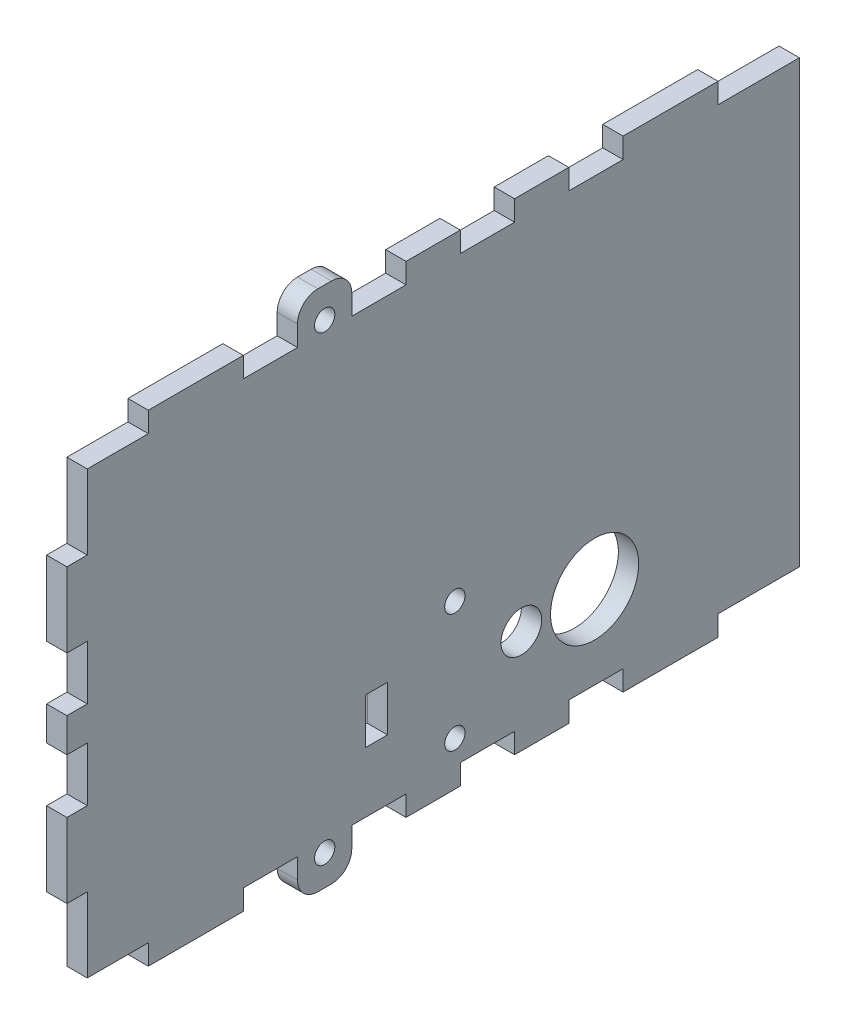
from build123d import *

# Parameters (mm, degrees)
CROQUIS1_W               = 108
CROQUIS1_H               = 71
SALIENTE_EXTRUIR1_DEPTH  = 1.5
CROQUIS2_W               = 12
CROQUIS2_H               = 3
CROQUIS2_W_2             = 8
CORTAR_EXTRUIR1_DEPTH    = 3
CROQUIS6_W               = 3
CROQUIS6_H               = 14
CROQUIS6_H_2             = 8
CORTAR_EXTRUIR3_DEPTH    = 3
CROQUIS7_R               = 1.5
CROQUIS7_R_2             = 3
CROQUIS7_R_3             = 6.5
CROQUIS7_W               = 3.259373519
CROQUIS7_H               = 6.723882433
CORTAR_EXTRUIR4_DEPTH    = 23
CROQUIS8_W               = 8
CROQUIS8_H               = 3
SALIENTE_EXTRUIR2_DEPTH  = 3
REDONDEO2_R              = 3
CROQUIS9_R               = 1.5
CORTAR_EXTRUIR5_DEPTH    = 3
REDONDEO2_OF_SIMETR_A1_R = 3


with BuildPart() as part:
    # Croquis1 → Saliente-Extruir1 (new, symmetric)
    with BuildSketch(Plane(origin=(0, 0, 0), x_dir=(0, 0, -1), z_dir=(1, 0, 0))):
        Rectangle(CROQUIS1_W, CROQUIS1_H)
    extrude(amount=SALIENTE_EXTRUIR1_DEPTH, both=True)

    # Croquis2 → Cortar-Extruir1 (cut)
    with BuildSketch(Plane.ZY.offset(1.5)):
        with Locations((-48, -34)):
            Rectangle(CROQUIS2_W, CROQUIS2_H)
        with Locations((-24, -34)):
            Rectangle(CROQUIS2_W_2, CROQUIS2_H)
        with Locations((-8, -34)):
            Rectangle(CROQUIS2_W_2, CROQUIS2_H)
        with Locations((8, -34)):
            Rectangle(CROQUIS2_W_2, CROQUIS2_H)
        with Locations((24, -34)):
            Rectangle(CROQUIS2_W_2, CROQUIS2_H)
        with Locations((48, -34)):
            Rectangle(CROQUIS2_W, CROQUIS2_H)
        with Locations((48, 34)):
            Rectangle(CROQUIS2_W, CROQUIS2_H)
        with Locations((24, 34)):
            Rectangle(CROQUIS2_W_2, CROQUIS2_H)
        with Locations((8, 34)):
            Rectangle(CROQUIS2_W_2, CROQUIS2_H)
        with Locations((-8, 34)):
            Rectangle(CROQUIS2_W_2, CROQUIS2_H)
        with Locations((-24, 34)):
            Rectangle(CROQUIS2_W_2, CROQUIS2_H)
        with Locations((-48, 34)):
            Rectangle(CROQUIS2_W, CROQUIS2_H)
    extrude(amount=-CORTAR_EXTRUIR1_DEPTH, mode=Mode.SUBTRACT)

    # Croquis6 → Cortar-Extruir3 (cut)
    with BuildSketch(Plane.ZY.offset(1.5)):
        with Locations((52.5, -28.5)):
            Rectangle(CROQUIS6_W, CROQUIS6_H)
        with Locations((52.5, -6.5)):
            Rectangle(CROQUIS6_W, CROQUIS6_H_2)
        with Locations((52.5, 6.5)):
            Rectangle(CROQUIS6_W, CROQUIS6_H_2)
        with Locations((52.5, 28.5)):
            Rectangle(CROQUIS6_W, CROQUIS6_H)
    extrude(amount=-CORTAR_EXTRUIR3_DEPTH, mode=Mode.SUBTRACT)

    # Croquis7 → Cortar-Extruir4 (cut)
    with BuildSketch(Plane.ZY.offset(1.5)):
        with Locations((-3.2, -11.5)):
            Circle(CROQUIS7_R)
        with Locations((-3.2, -29)):
            Circle(CROQUIS7_R)
        with Locations((-13, -20.25)):
            Circle(CROQUIS7_R_2)
        with Locations((-23.8, -20.25)):
            Circle(CROQUIS7_R_3)
        with Locations((8.36450747, -20.229697644)):
            Rectangle(CROQUIS7_W, CROQUIS7_H)
    extrude(amount=-CORTAR_EXTRUIR4_DEPTH, mode=Mode.SUBTRACT)

    # Croquis8 → Saliente-Extruir2 (add)
    with BuildSketch(Plane.ZY.offset(1.5)):
        with Locations((16, 37)):
            Rectangle(CROQUIS8_W, CROQUIS8_H)
    saliente_extruir2 = extrude(amount=-SALIENTE_EXTRUIR2_DEPTH)

    # Redondeo2
    redondeo2_edges = [part.edges().sort_by_distance(p)[0] for p in [
        (0, 38.5, 12),
        (0, 38.5, 20),
    ]]
    fillet(redondeo2_edges, radius=REDONDEO2_R)

    # Croquis9 → Cortar-Extruir5 (cut)
    with BuildSketch(Plane.ZY.offset(1.5)):
        with Locations((16, 34)):
            Circle(CROQUIS9_R)
    cortar_extruir5 = extrude(amount=-CORTAR_EXTRUIR5_DEPTH, mode=Mode.SUBTRACT)

    # Simetría1: Saliente-Extruir2, Cortar-Extruir5 across plane
    add(saliente_extruir2.mirror(Plane.ZX))
    add(cortar_extruir5.mirror(Plane.ZX), mode=Mode.SUBTRACT)

    # Redondeo2 of Simetría1
    redondeo2_of_simetr_a1_edges = [part.edges().sort_by_distance(p)[0] for p in [
        (0, -38.5, 12),
        (0, -38.5, 20),
    ]]
    fillet(redondeo2_of_simetr_a1_edges, radius=REDONDEO2_OF_SIMETR_A1_R)


solid = part.part
